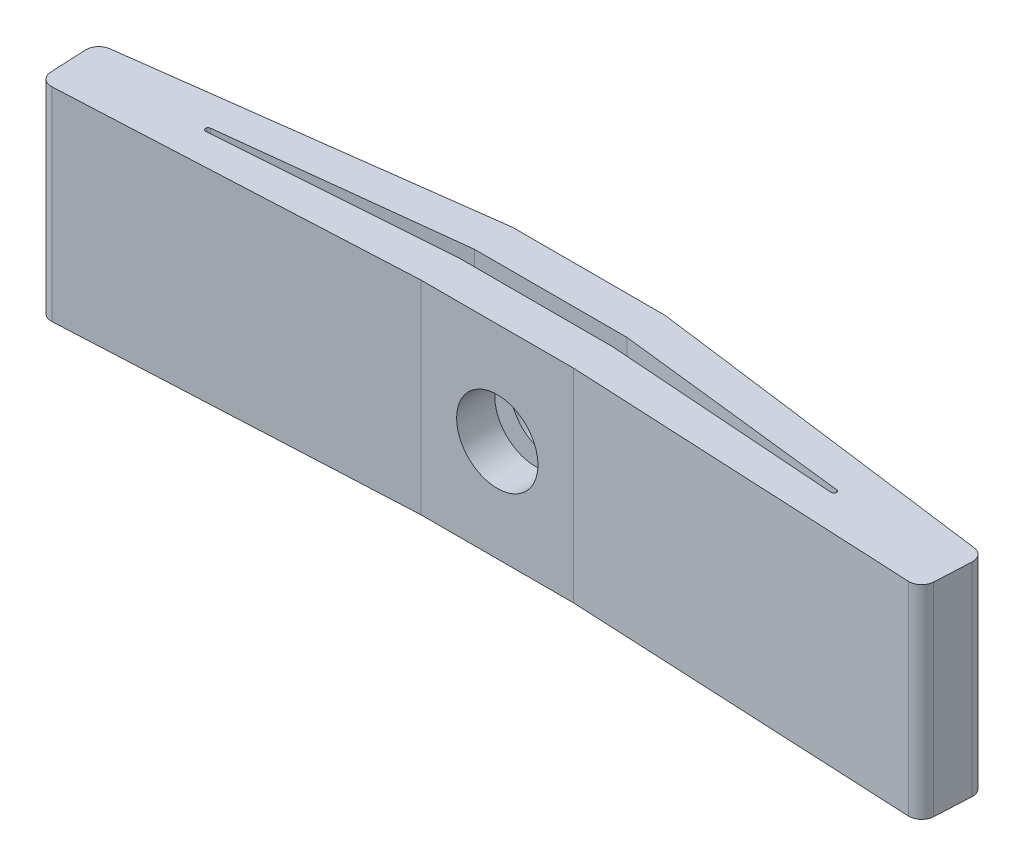
from build123d import *

# Parameters (mm, degrees)
BOSS_EXTRUDE1_DEPTH       = 8
FILLET1_R                 = 0.1
FILLET2_R                 = 0.5
SKETCH2_R                 = 1.6
CUT_EXTRUDE1_DEPTH        = 36.95822091
REVISION_INDICATION_DEPTH = 0.4


with BuildPart() as part:
    # Sketch1 → Boss-Extrude1 (new body)
    with BuildSketch(Plane(origin=(0, 0, 0), x_dir=(1, 0, 0), z_dir=(0, 1, 0))):
        Polygon((20.35, 0.7), (14.35, 0.7), (0, 0), (-0.117073171, 2.4), (14.35, 4.3), (20.35, 4.3), (34.817073171, 2.4), (34.7, 0), align=None)
        Polygon((20.35, 2.2), (14.35, 2.2), (0.35, 1.2), (14.35, 2.8), (20.35, 2.8), (34.35, 1.2), align=None, mode=Mode.SUBTRACT)
    extrude(amount=BOSS_EXTRUDE1_DEPTH)

    # Fillet1
    fillet1_edges = [part.edges().sort_by_distance(p)[0] for p in [
        (0.35, 4, -1.2),
        (34.35, 4, -1.2),
    ]]
    fillet(fillet1_edges, radius=FILLET1_R)

    # Fillet2
    fillet2_edges = [part.edges().sort_by_distance(p)[0] for p in [
        (-0.117073171, 4, -2.4),
        (34.817073171, 4, -2.4),
        (34.7, 4, 0),
        (0, 4, 0),
    ]]
    fillet(fillet2_edges, radius=FILLET2_R)

    # Sketch2 → Cut-Extrude1 (cut, through all)
    with BuildSketch(Plane(origin=(0, 0, -4.3), x_dir=(-1, 0, 0), z_dir=(0, 0, -1))):
        with Locations((-17.35, 4)):
            Circle(SKETCH2_R)
    extrude(amount=-CUT_EXTRUDE1_DEPTH, mode=Mode.SUBTRACT)

    # Sketch5 → revision indication (add)
    with BuildSketch(Plane(origin=(-0.311839138, 0, -2.374420857), x_dir=(-0.9914858429395939, 0, 0.13021452780071538), z_dir=(-0.13021452780071538, 0, -0.9914858429395939))):
        with BuildLine():
            add(Edge.make_bspline(
                [(-1.75614285, 1.976923077), (-1.720782037, 1.974821832), (-1.651461296, 1.970702586), (-1.551241734, 1.942442049), (-1.460537137, 1.892261337), (-1.379742922, 1.825381725), (-1.313146886, 1.744291021), (-1.261177847, 1.654309873), (-1.233163488, 1.553251269), (-1.229074248, 1.483528859), (-1.226976184, 1.44775641)],
                knots=[0, 0, 0, 0, 1.020151414, 1.999887582, 2.974338812, 3.990962822, 5.007586832, 5.987933904, 6.967670073, 8, 8, 8, 8], degree=3))
            add(Edge.make_bspline(
                [(-1.226976184, 1.44775641), (-1.229145345, 1.412843512), (-1.233422899, 1.343995789), (-1.261113631, 1.243699421), (-1.313542951, 1.153662038), (-1.379283581, 1.071471016), (-1.46055711, 1.004449722), (-1.551456175, 0.954695939), (-1.651226029, 0.924411918), (-1.720742787, 0.920554208), (-1.75614285, 0.918589744)],
                knots=[0, 0, 0, 0, 1.009421747, 1.99056486, 2.972319754, 3.999869655, 5.017953583, 5.993804169, 6.978383603, 8, 8, 8, 8], degree=3))
            add(Edge.make_bspline(
                [(-1.75614285, 0.918589744), (-1.791568422, 0.920483127), (-1.860728417, 0.924179507), (-1.960125864, 0.955317742), (-2.051578507, 1.003983162), (-2.132836213, 1.071595984), (-2.19912744, 1.153239101), (-2.249247777, 1.244319503), (-2.279347047, 1.343708683), (-2.283305588, 1.412786963), (-2.285309517, 1.44775641)],
                knots=[0, 0, 0, 0, 1.022052826, 1.995314843, 2.982371812, 4.00089066, 5.028879526, 6.005146991, 6.990147033, 8, 8, 8, 8], degree=3))
            add(Edge.make_bspline(
                [(-2.285309517, 1.44775641), (-2.283382565, 1.483587428), (-2.279620429, 1.553543092), (-2.249184588, 1.653690044), (-2.199516318, 1.744709926), (-2.132377959, 1.825258007), (-2.051598165, 1.892726399), (-1.960346478, 1.941829667), (-1.860489026, 1.970931558), (-1.791528138, 1.974891267), (-1.75614285, 1.976923077)],
                knots=[0, 0, 0, 0, 1.032775665, 2.016367738, 2.991239715, 4.008302682, 5.025365648, 6.011011707, 6.979408107, 8, 8, 8, 8], degree=3))
        make_face()
        with BuildLine():
            add(Edge.make_bspline(
                [(-4.117040286, 1.976923077), (-4.081679473, 1.974821832), (-4.012358732, 1.970702586), (-3.91213917, 1.942442049), (-3.821434573, 1.892261337), (-3.740640358, 1.825381725), (-3.674044322, 1.744291021), (-3.622075283, 1.654309873), (-3.594060924, 1.553251269), (-3.589971684, 1.483528859), (-3.587873619, 1.44775641)],
                knots=[0, 0, 0, 0, 1.020151414, 1.999887582, 2.974338812, 3.990962822, 5.007586832, 5.987933904, 6.967670073, 8, 8, 8, 8], degree=3))
            add(Edge.make_bspline(
                [(-3.587873619, 1.44775641), (-3.590042781, 1.412843512), (-3.594320335, 1.343995789), (-3.622011067, 1.243699421), (-3.674440387, 1.153662038), (-3.740181017, 1.071471016), (-3.821454546, 1.004449722), (-3.91235361, 0.954695939), (-4.012123464, 0.924411918), (-4.081640223, 0.920554208), (-4.117040286, 0.918589744)],
                knots=[0, 0, 0, 0, 1.009421747, 1.99056486, 2.972319754, 3.999869655, 5.017953583, 5.993804169, 6.978383603, 8, 8, 8, 8], degree=3))
            add(Edge.make_bspline(
                [(-4.117040286, 0.918589744), (-4.152465858, 0.920483127), (-4.221625853, 0.924179507), (-4.3210233, 0.955317742), (-4.412475943, 1.003983162), (-4.493733649, 1.071595984), (-4.560024876, 1.153239101), (-4.610145213, 1.244319503), (-4.640244483, 1.343708683), (-4.644203024, 1.412786963), (-4.646206953, 1.44775641)],
                knots=[0, 0, 0, 0, 1.022052826, 1.995314843, 2.982371812, 4.00089066, 5.028879526, 6.005146991, 6.990147033, 8, 8, 8, 8], degree=3))
            add(Edge.make_bspline(
                [(-4.646206953, 1.44775641), (-4.644280001, 1.483587428), (-4.640517865, 1.553543092), (-4.610082024, 1.653690044), (-4.560413754, 1.744709926), (-4.493275395, 1.825258007), (-4.412495601, 1.892726399), (-4.321243914, 1.941829667), (-4.221386462, 1.970931558), (-4.152425574, 1.974891267), (-4.117040286, 1.976923077)],
                knots=[0, 0, 0, 0, 1.032775665, 2.016367738, 2.991239715, 4.008302682, 5.025365648, 6.011011707, 6.979408107, 8, 8, 8, 8], degree=3))
        make_face()
    extrude(amount=REVISION_INDICATION_DEPTH)


solid = part.part
